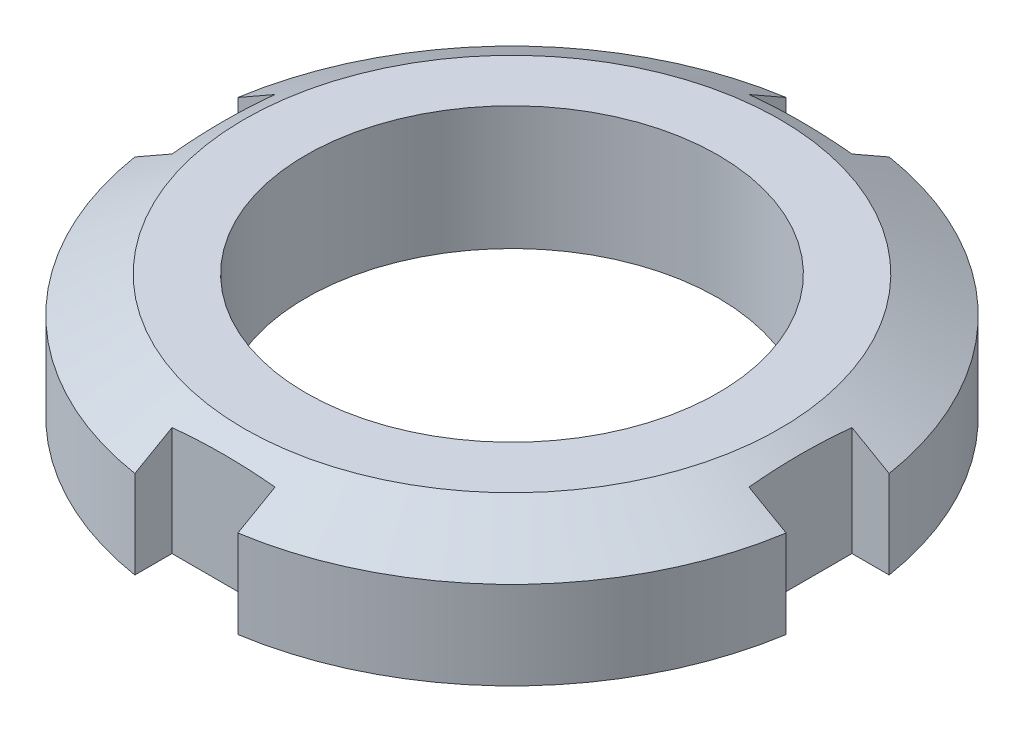
from build123d import *

# Parameters (mm, degrees)
CROQUIS1_R              = 16
CROQUIS1_R_2            = 10
SALIENTE_EXTRUIR1_DEPTH = 6
CROQUIS2_W              = 5
CROQUIS2_H              = 2
CROQUIS2_W_2            = 2
CROQUIS2_H_2            = 5
CORTAR_EXTRUIR1_DEPTH   = 6


with BuildPart() as part:
    # Croquis1 → Saliente-Extruir1 (new body)
    with BuildSketch(Plane(origin=(0, 0, 0), x_dir=(1, 0, 0), z_dir=(0, 1, 0))):
        with Locations(Location((0, 0, 0), (0, 0, 270))):
            Circle(CROQUIS1_R)
        with Locations(Location((0, 0, 0), (0, 0, 270))):
            Circle(CROQUIS1_R_2, mode=Mode.SUBTRACT)
    extrude(amount=SALIENTE_EXTRUIR1_DEPTH)

    # Croquis2 → Cortar-Extruir1 (cut)
    with BuildSketch(Plane(origin=(0, 6, 0), x_dir=(1, 0, 0), z_dir=(0, 1, 0))):
        with Locations((0, 15)):
            Rectangle(CROQUIS2_W, CROQUIS2_H)
        with Locations((0, -15)):
            Rectangle(CROQUIS2_W, CROQUIS2_H)
        with Locations((15, 0)):
            Rectangle(CROQUIS2_W_2, CROQUIS2_H_2)
        with Locations((-15, 0)):
            Rectangle(CROQUIS2_W_2, CROQUIS2_H_2)
    extrude(amount=-CORTAR_EXTRUIR1_DEPTH, mode=Mode.SUBTRACT)

    # Croquis3 → Cortar-Revolución1 (revolve, cut)
    with BuildSketch(Plane(origin=(0, 0, 0), x_dir=(0, 0, -1), z_dir=(1, 0, 0)), mode=Mode.PRIVATE) as cortar_revoluci_n1_sk:
        Polygon((-16, 6), (-13, 6), (-16, 4.267949192), align=None)
    revolve(cortar_revoluci_n1_sk.sketch.rotate(Axis((0, 6, 0), (0, -1, 0)), 171.010700805), axis=Axis((0, 6, 0), (0, -1, 0)), mode=Mode.SUBTRACT)


solid = part.part
